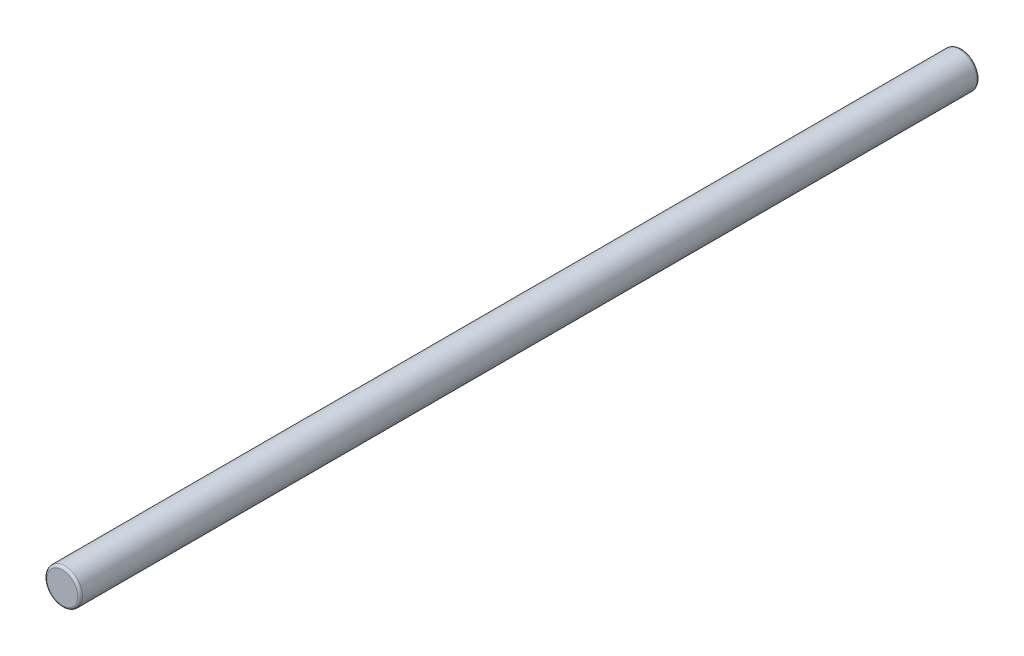
from build123d import *

# Parameters (mm, degrees)
ESBO_O1_R                = 1.5
RESSALTO_EXTRUS_O1_DEPTH = 76
FILETE1_R                = 0.2


with BuildPart() as part:
    # Esboço1 → Ressalto-extrusão1 (new body)
    with BuildSketch(Plane.XY):
        Circle(ESBO_O1_R)
    extrude(amount=RESSALTO_EXTRUS_O1_DEPTH)

    # Filete1
    filete1_edges = [part.edges().sort_by_distance(p)[0] for p in [
        (-1.5, 0, 0),
        (-1.5, 0, 76),
    ]]
    fillet(filete1_edges, radius=FILETE1_R)


solid = part.part
